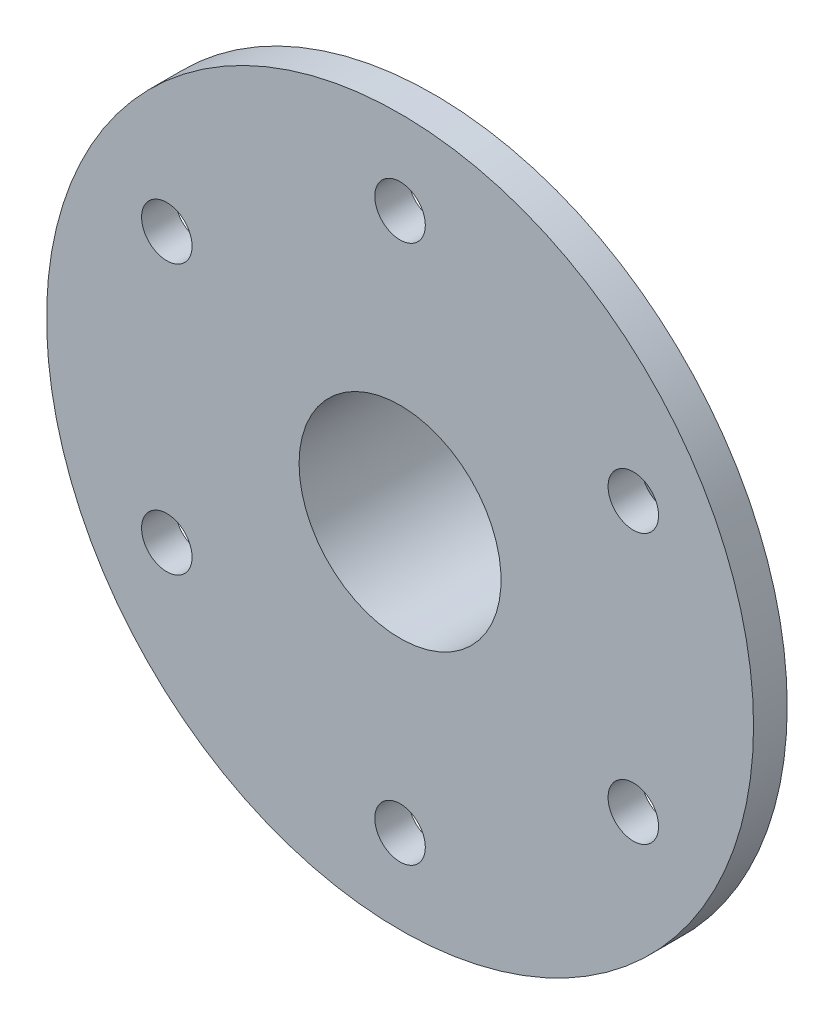
from build123d import *

# Parameters (mm, degrees)
SKETCH_1_R          = 9.985
EXTRUDE_1_DEPTH     = 4
SKETCH_2_R          = 11.5
EXTRUDE_2_DEPTH     = 3
SKETCH_3_R          = 21
SKETCH_3_R_2        = 1.5
EXTRUDE_3_DEPTH     = 2
SKETCH_4_R          = 6
CUT_EXTRUDE_1_DEPTH = 32.032241298
FILLET_1_R          = 1.5


with BuildPart() as part:
    # 草图1 → 凸台-拉伸1 (new body)
    with BuildSketch(Plane.XY):
        Circle(SKETCH_1_R)
    extrude(amount=EXTRUDE_1_DEPTH)

    # 草图2 → 凸台-拉伸2 (add)
    with BuildSketch(Plane.XY.offset(4)):
        Circle(SKETCH_2_R)
    extrude(amount=EXTRUDE_2_DEPTH)

    # 草图3 → 凸台-拉伸3 (add)
    with BuildSketch(Plane.XY.offset(7)):
        Circle(SKETCH_3_R)
        with Locations((0, 16)):
            Circle(SKETCH_3_R_2, mode=Mode.SUBTRACT)
        with Locations((13.856406461, 8)):
            Circle(SKETCH_3_R_2, mode=Mode.SUBTRACT)
        with Locations((13.856406461, -8)):
            Circle(SKETCH_3_R_2, mode=Mode.SUBTRACT)
        with Locations((0, -16)):
            Circle(SKETCH_3_R_2, mode=Mode.SUBTRACT)
        with Locations((-13.856406461, -8)):
            Circle(SKETCH_3_R_2, mode=Mode.SUBTRACT)
        with Locations((-13.856406461, 8)):
            Circle(SKETCH_3_R_2, mode=Mode.SUBTRACT)
    extrude(amount=EXTRUDE_3_DEPTH)

    # 草图4 → 切除-拉伸1 (cut, through all)
    with BuildSketch(Plane(origin=(0, 0, 0), x_dir=(-1, 0, 0), z_dir=(0, 0, -1))):
        Circle(SKETCH_4_R)
    extrude(amount=-CUT_EXTRUDE_1_DEPTH, mode=Mode.SUBTRACT)

    # 圆角1
    fillet_1_edges = [part.edges().sort_by_distance(p)[0] for p in [
        (-11.5, 0, 7),
    ]]
    fillet(fillet_1_edges, radius=FILLET_1_R)


solid = part.part
